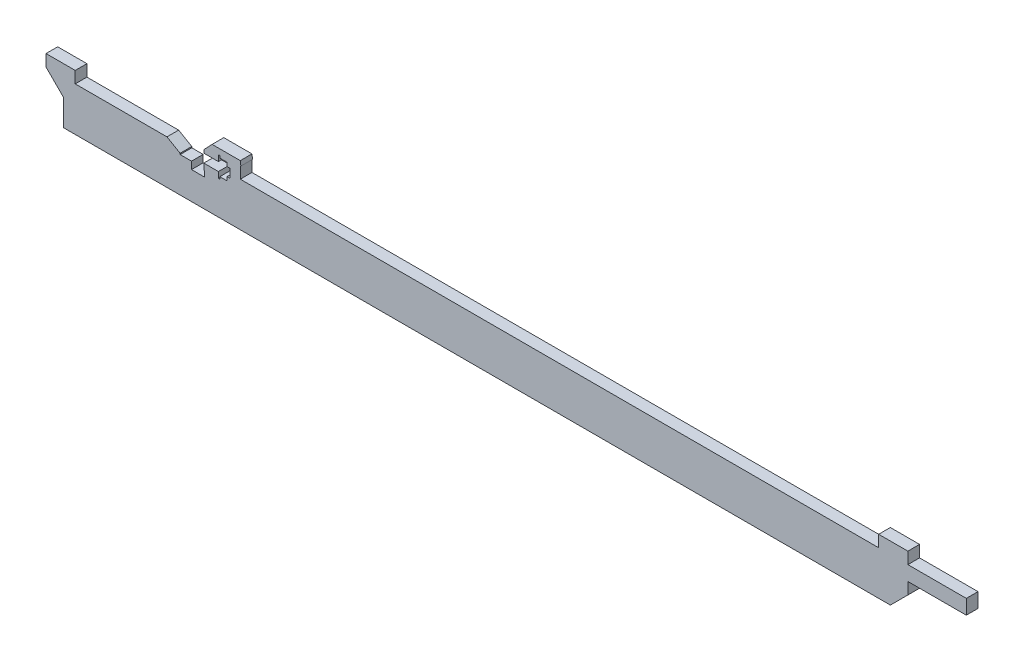
from build123d import *

# Parameters (mm, degrees)
BOSS_EXTRUDE1_DEPTH = 4
CHAMFER1_SIZE       = 6
CHAMFER2_SIZE       = 2.6
CHAMFER2_SIZE2      = 4.5033321
SKETCH2_R           = 0.464535938
CUT_EXTRUDE1_DEPTH  = 0.5


with BuildPart() as part:
    # Sketch1 → Boss-Extrude1 (new body)
    with BuildSketch(Plane.XY):
        Polygon((0, 0), (20, 0), (20, 5), (0, 5), (0, 9), (-10, 9), (-10, 5), (-228.5, 5), (-228.5, 9), (-228.3, 9), (-228.5, 10.5), (-238.142857143, 10.5), (-241, 7.5), (-241, 6.475), (-236, 6.475), (-236, 8.5), (-235.5, 8.5), (-235.5, 7.75), (-233, 7.75), (-233, 6.475), (-232, 6.475), (-232, 3.525), (-233, 3.525), (-233, 2.25), (-235.5, 2.25), (-235.5, 1.5), (-236, 1.5), (-236, 3.525), (-241, 3.525), (-241, 2.5), (-240.8, 1.134476763), (-240.8, -0.5), (-245.2, -0.5), (-245.2, 2), (-249.093151184, 2), (-249.093151184, 5), (-285, 5), (-285, 9), (-295, 9), (-295, 5), (-289, -1), (-289, -10), (0, -10), align=None)
    extrude(amount=BOSS_EXTRUDE1_DEPTH)

    # Chamfer1
    chamfer1_edges = [part.edges().sort_by_distance(p)[0] for p in [
        (0, -10, 2),
    ]]
    chamfer(chamfer1_edges, length=CHAMFER1_SIZE)

    # Chamfer2
    chamfer2_edges = [part.edges().sort_by_distance(p)[0] for p in [
        (-249.093151184, 5, 2),
    ]]
    chamfer2_side = [part.faces().sort_by_distance(p)[0] for p in [
        (-249.093151184, 3.5, 2),
    ]]
    chamfer(chamfer2_edges, length=CHAMFER2_SIZE, length2=CHAMFER2_SIZE2, reference=chamfer2_side[0])

    # Sketch2 → Cut-Extrude1 (cut)
    with BuildSketch(Plane.ZY.offset(232)):
        with Locations((2, 5)):
            Circle(SKETCH2_R)
    extrude(amount=-CUT_EXTRUDE1_DEPTH, mode=Mode.SUBTRACT)


solid = part.part
